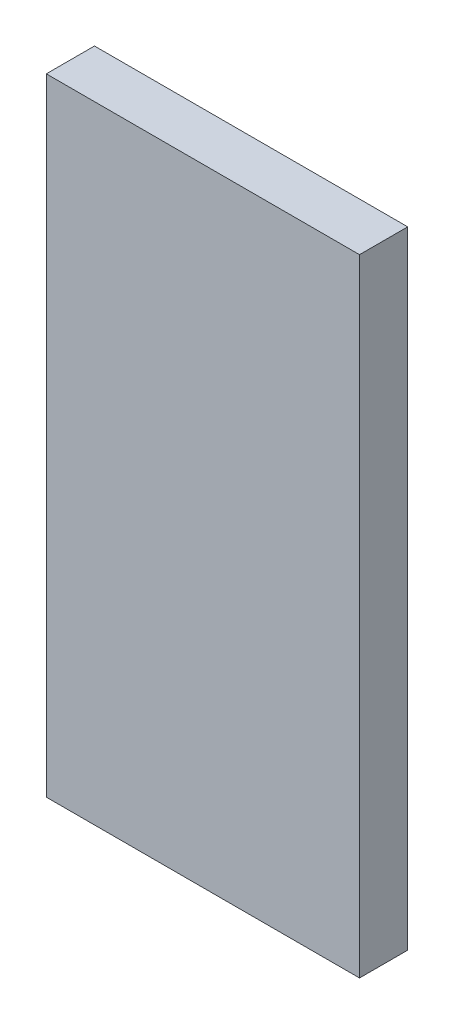
from build123d import *

# Parameters (mm, degrees)
SKETCH1_W           = 82.55
SKETCH1_H           = 165.1
BOSS_EXTRUDE1_DEPTH = 12.7


with BuildPart() as part:
    # Sketch1 → Boss-Extrude1 (new body)
    with BuildSketch(Plane.XY):
        Rectangle(SKETCH1_W, SKETCH1_H)
    extrude(amount=BOSS_EXTRUDE1_DEPTH)


solid = part.part
